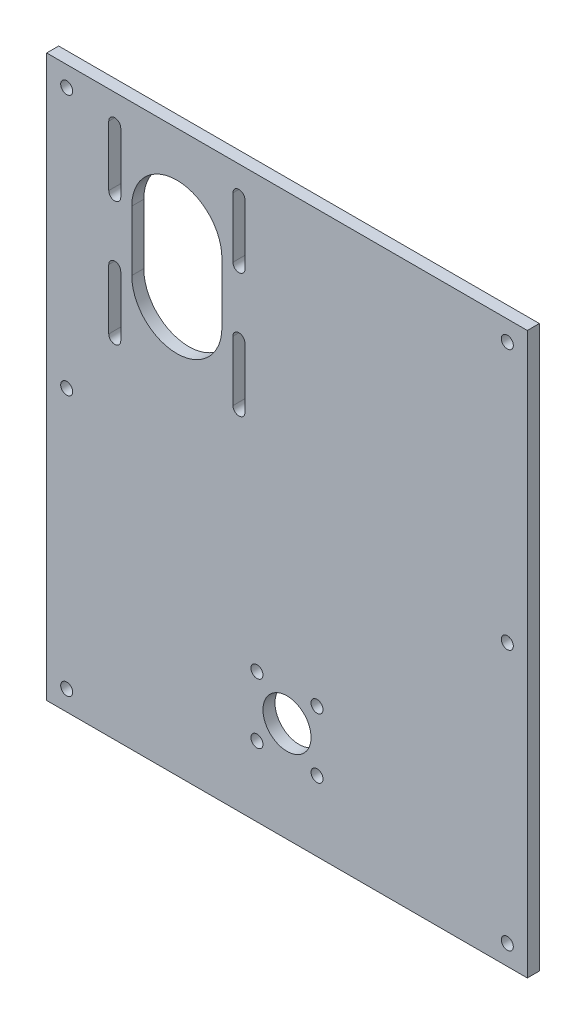
from build123d import *

# Parameters (mm, degrees)
BOSS_EXTRU_1_DEPTH      = 3
ESQUISSE2_R             = 1.5
ENL_V_MAT_EXTRU_2_DEPTH = 3
ESQUISSE3_R             = 6
ESQUISSE3_R_2           = 1.5
ENL_V_MAT_EXTRU_3_DEPTH = 10
ESQUISSE4_W             = 100
ESQUISSE4_H             = 11.457187309
ENL_V_MAT_EXTRU_4_DEPTH = 10


with BuildPart() as part:
    # Esquisse1 → Boss.-Extru.1 (new body)
    with BuildSketch(Plane.XY):
        Polygon((-50, -75), (50, -75), (50, -65), (60, -65), (60, 75), (-60, 75), (-60, -65), (-50, -65), align=None)
        with BuildLine():
            ThreePointArc((-41.5, 22), (-43, 20.5), (-44.5, 22))
            Line((-44.5, 22), (-44.5, 37))
            ThreePointArc((-44.5, 37), (-43, 38.5), (-41.5, 37))
            Line((-41.5, 37), (-41.5, 22))
        make_face(mode=Mode.SUBTRACT)
        with BuildLine():
            Line((-10.5, 37), (-10.5, 22))
            ThreePointArc((-10.5, 22), (-12, 20.5), (-13.5, 22))
            Line((-13.5, 22), (-13.5, 37))
            ThreePointArc((-13.5, 37), (-12, 38.5), (-10.5, 37))
        make_face(mode=Mode.SUBTRACT)
        with BuildLine():
            ThreePointArc((-41.5, 53), (-43, 51.5), (-44.5, 53))
            Line((-44.5, 53), (-44.5, 68))
            ThreePointArc((-44.5, 68), (-43, 69.5), (-41.5, 68))
            Line((-41.5, 68), (-41.5, 53))
        make_face(mode=Mode.SUBTRACT)
        with BuildLine():
            ThreePointArc((-16.25, 37.5), (-27.5, 26.25), (-38.75, 37.5))
            Line((-38.75, 37.5), (-38.75, 52.5))
            ThreePointArc((-38.75, 52.5), (-27.5, 63.75), (-16.25, 52.5))
            Line((-16.25, 52.5), (-16.25, 37.5))
        make_face(mode=Mode.SUBTRACT)
        with BuildLine():
            Line((-10.5, 68), (-10.5, 53))
            ThreePointArc((-10.5, 53), (-12, 51.5), (-13.5, 53))
            Line((-13.5, 53), (-13.5, 68))
            ThreePointArc((-13.5, 68), (-12, 69.5), (-10.5, 68))
        make_face(mode=Mode.SUBTRACT)
    extrude(amount=BOSS_EXTRU_1_DEPTH)

    # Esquisse2 → Enlèv. mat.-Extru.2 (cut)
    with BuildSketch(Plane.XY.offset(3)):
        with Locations((45, -70)):
            Circle(ESQUISSE2_R)
        with Locations((-55, -60)):
            Circle(ESQUISSE2_R)
        with Locations((-55, 5)):
            Circle(ESQUISSE2_R)
        with Locations((-55, 70)):
            Circle(ESQUISSE2_R)
        with Locations((22.5, -70)):
            Circle(ESQUISSE2_R)
        with Locations((0, -70)):
            Circle(ESQUISSE2_R)
        with Locations((-22.5, -70)):
            Circle(ESQUISSE2_R)
        with Locations((-45, -70)):
            Circle(ESQUISSE2_R)
        with Locations(Location((55, -60, 0), (0, 0, 180))):
            Circle(ESQUISSE2_R)
        with Locations(Location((55, 5, 0), (0, 0, 180))):
            Circle(ESQUISSE2_R)
        with Locations(Location((55, 70, 0), (0, 0, 180))):
            Circle(ESQUISSE2_R)
    extrude(amount=-ENL_V_MAT_EXTRU_2_DEPTH, mode=Mode.SUBTRACT)

    # Esquisse3 → Enlèv. mat.-Extru.3 (cut)
    with BuildSketch(Plane.XY.offset(3)):
        with Locations((0, -40)):
            Circle(ESQUISSE3_R)
        with Locations((-7.5, -32.5)):
            Circle(ESQUISSE3_R_2)
        with Locations((7.5, -32.5)):
            Circle(ESQUISSE3_R_2)
        with Locations((7.5, -47.5)):
            Circle(ESQUISSE3_R_2)
        with Locations((-7.5, -47.5)):
            Circle(ESQUISSE3_R_2)
    extrude(amount=-ENL_V_MAT_EXTRU_3_DEPTH, mode=Mode.SUBTRACT)

    # Esquisse4 → Enlèv. mat.-Extru.4 (cut)
    with BuildSketch(Plane.XY.offset(3)):
        with Locations((0, -70.728593655)):
            Rectangle(ESQUISSE4_W, ESQUISSE4_H)
    extrude(amount=-ENL_V_MAT_EXTRU_4_DEPTH, mode=Mode.SUBTRACT)


solid = part.part
